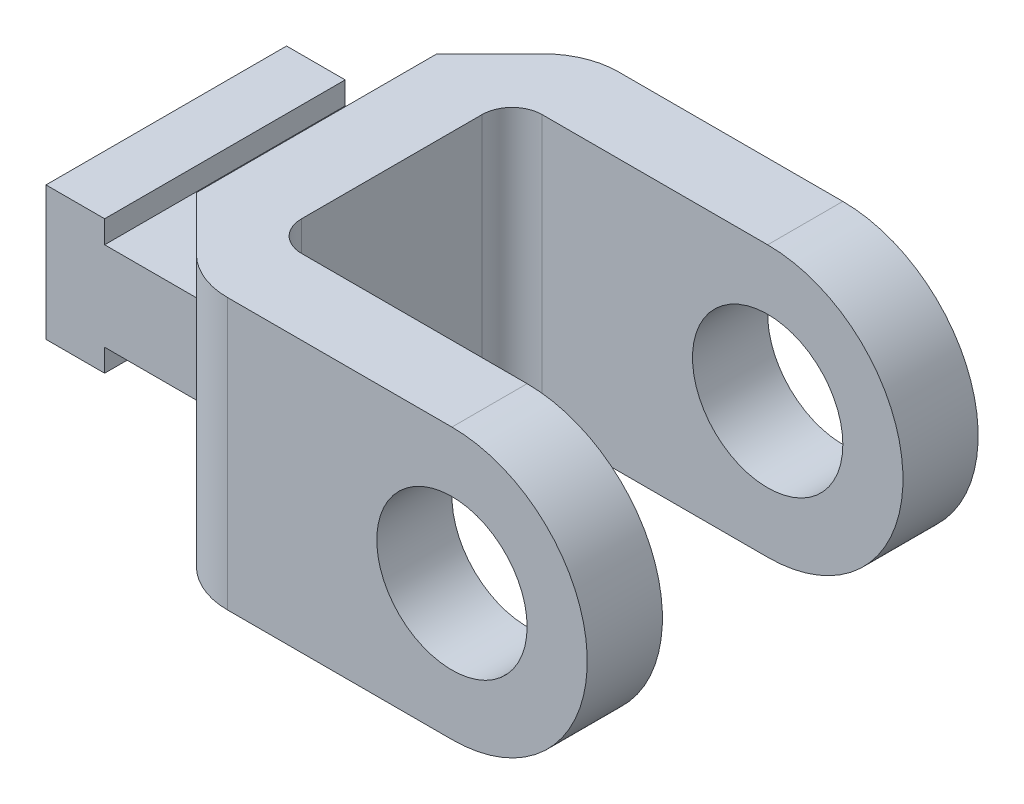
from build123d import *

# Parameters (mm, degrees)
BOSS_EXTRUDE1_DEPTH  = 8
SKETCH2_R            = 2.5
BOSS_EXTRUDE3_DEPTH  = 2.5
CUT_EXTRUDE2_DEPTH   = 19.656433207
FILLET5_R            = 1
FILLET6_R            = 2.5
FILLET5_OF_MIRROR2_R = 1
FILLET6_OF_MIRROR2_R = 2.5


with BuildPart() as part:
    # Sketch1 → Boss-Extrude1 (new body)
    with BuildSketch(Plane.XY):
        Polygon((1.25, -4.5), (-1.25, -4.5), (-1.25, -1.475), (-4.3, -1.475), (-4.3, -2.225), (-6.25, -2.225), (-6.25, 2.225), (-4.3, 2.225), (-4.3, 1.475), (-1.25, 1.475), (-1.25, 4.5), (1.25, 4.5), align=None)
    extrude(amount=BOSS_EXTRUDE1_DEPTH)

    # Sketch2 → Boss-Extrude3 (add)
    with BuildSketch(Plane.XY):
        with BuildLine():
            Line((9.75, -4.5), (-1.25, -4.5))
            Line((-1.25, -4.5), (-1.25, 4.5))
            Line((-1.25, 4.5), (9.75, 4.5))
            ThreePointArc((9.75, 4.5), (14.25, 0), (9.75, -4.5))
        make_face()
        with Locations((9.75, 0)):
            Circle(SKETCH2_R, mode=Mode.SUBTRACT)
    boss_extrude3 = extrude(amount=-BOSS_EXTRUDE3_DEPTH)

    # Sketch5 → Cut-Extrude2 (cut, symmetric)
    with BuildSketch(Plane(origin=(0, 4.5, 0), x_dir=(1, 0, 0), z_dir=(0, 1, 0))):
        Polygon((-1.25, 2.5), (1.25, 2.5), (-1.25, 0), align=None)
    cut_extrude2 = extrude(amount=CUT_EXTRUDE2_DEPTH, both=True, mode=Mode.SUBTRACT)

    # Fillet5
    fillet5_edges = [part.edges().sort_by_distance(p)[0] for p in [
        (1.25, 0, 0),
    ]]
    fillet(fillet5_edges, radius=FILLET5_R)

    # Fillet6
    fillet6_edges = [part.edges().sort_by_distance(p)[0] for p in [
        (1.25, 0, -2.5),
    ]]
    fillet(fillet6_edges, radius=FILLET6_R)

    # Mirror2: Boss-Extrude3, Cut-Extrude2 across plane
    add(boss_extrude3.mirror(Plane(origin=(0, 0, 4), x_dir=(1, 0, 0), z_dir=(0, 0, -1))))
    add(cut_extrude2.mirror(Plane(origin=(0, 0, 4), x_dir=(1, 0, 0), z_dir=(0, 0, -1))), mode=Mode.SUBTRACT)

    # Fillet5 of Mirror2
    fillet5_of_mirror2_edges = [part.edges().sort_by_distance(p)[0] for p in [
        (1.25, 0, 8),
    ]]
    fillet(fillet5_of_mirror2_edges, radius=FILLET5_OF_MIRROR2_R)

    # Fillet6 of Mirror2
    fillet6_of_mirror2_edges = [part.edges().sort_by_distance(p)[0] for p in [
        (1.25, 0, 10.5),
    ]]
    fillet(fillet6_of_mirror2_edges, radius=FILLET6_OF_MIRROR2_R)


solid = part.part
